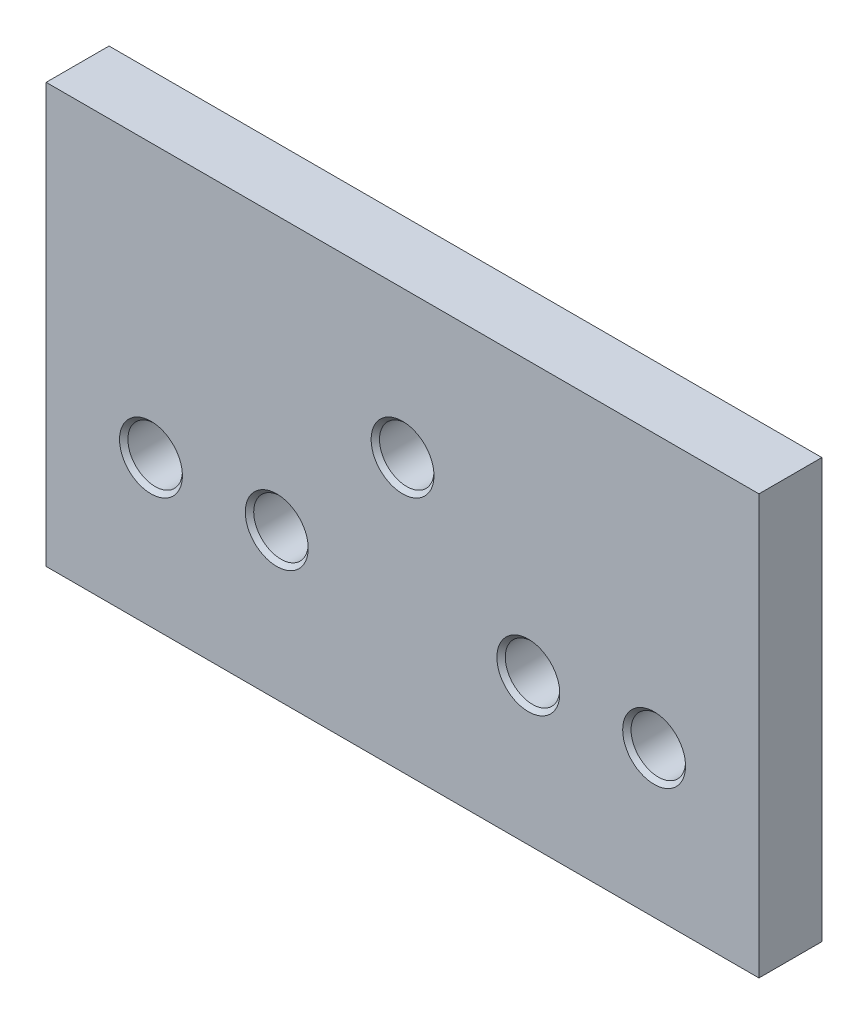
from build123d import *

# Parameters (mm, degrees)
SKETCH_1_W      = 34
SKETCH_1_H      = 20
SKETCH_1_R      = 1.3
EXTRUDE_1_DEPTH = 3
CHAMFER_1_SIZE  = 0.2


with BuildPart() as part:
    # 草圖1 → 填料-伸長1 (new body)
    with BuildSketch(Plane.XY):
        Rectangle(SKETCH_1_W, SKETCH_1_H)
        with Locations((0, 3)):
            Circle(SKETCH_1_R, mode=Mode.SUBTRACT)
        with Locations((-6, -3)):
            Circle(SKETCH_1_R, mode=Mode.SUBTRACT)
        with Locations((6, -3)):
            Circle(SKETCH_1_R, mode=Mode.SUBTRACT)
        with Locations((12, -3)):
            Circle(SKETCH_1_R, mode=Mode.SUBTRACT)
        with Locations((-12, -3)):
            Circle(SKETCH_1_R, mode=Mode.SUBTRACT)
    extrude(amount=EXTRUDE_1_DEPTH)

    # 導角1
    chamfer_1_edges = [part.edges().sort_by_distance(p)[0] for p in [
        (-13.3, -3, 3),
        (-1.3, 3, 3),
        (4.7, -3, 3),
        (-7.3, -3, 3),
        (10.7, -3, 3),
    ]]
    chamfer(chamfer_1_edges, length=CHAMFER_1_SIZE)


solid = part.part
